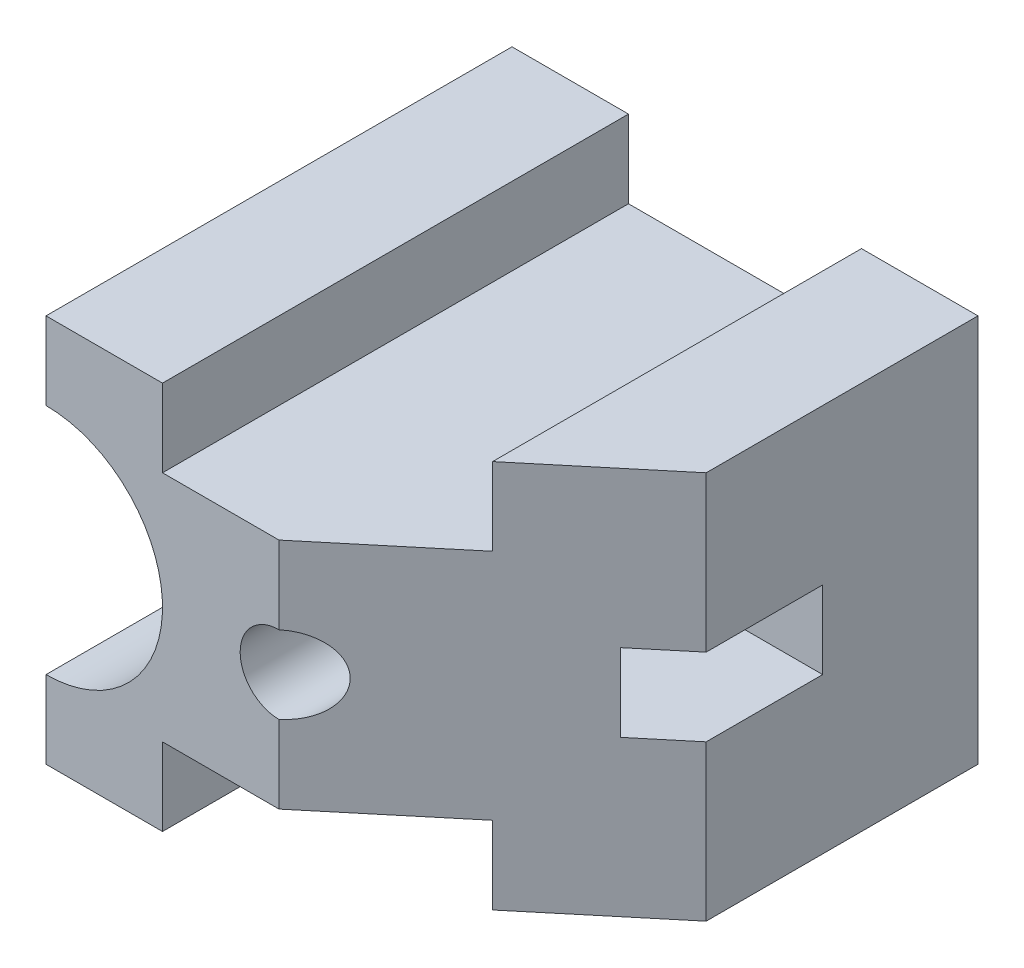
from build123d import *

# Parameters (mm, degrees)
SKETCH1_R           = 5
BOSS_EXTRUDE1_DEPTH = 60
CUT_EXTRUDE3_DEPTH  = 60
SKETCH7_W           = 20
SKETCH7_H           = 10
CUT_EXTRUDE4_DEPTH  = 60


with BuildPart() as part:
    # Sketch1 → Boss-Extrude1 (new body)
    with BuildSketch(Plane.XY):
        with BuildLine():
            Line((-23.203125, -22.890625), (-23.203125, -32.890625))
            Line((-23.203125, -32.890625), (-38.203125, -32.890625))
            Line((-38.203125, -32.890625), (-38.203125, -22.890625))
            ThreePointArc((-38.203125, -22.890625), (-23.203125, -7.890625), (-38.203125, 7.109375))
            Line((-38.203125, 7.109375), (-38.203125, 17.109375))
            Line((-38.203125, 17.109375), (-23.203125, 17.109375))
            Line((-23.203125, 17.109375), (-23.203125, 7.109375))
            Line((-23.203125, 7.109375), (6.796875, 7.109375))
            Line((6.796875, 7.109375), (6.796875, 17.109375))
            Line((6.796875, 17.109375), (21.796875, 17.109375))
            Line((21.796875, 17.109375), (21.796875, -32.890625))
            Line((21.796875, -32.890625), (6.796875, -32.890625))
            Line((6.796875, -32.890625), (6.796875, -22.890625))
            Line((6.796875, -22.890625), (-23.203125, -22.890625))
        make_face()
        with Locations((-8.203125, -7.890625)):
            Circle(SKETCH1_R, mode=Mode.SUBTRACT)
    extrude(amount=BOSS_EXTRUDE1_DEPTH)

    # Sketch3 → Cut-Extrude3 (cut)
    with BuildSketch(Plane(origin=(0, 17.109375, 0), x_dir=(1, 0, 0), z_dir=(0, 1, 0))):
        Polygon((-8.203125, -60), (21.796875, -35), (21.796875, -60), align=None)
    extrude(amount=-CUT_EXTRUDE3_DEPTH, mode=Mode.SUBTRACT)

    # Sketch7 → Cut-Extrude4 (cut)
    with BuildSketch(Plane(origin=(21.796875, 0, 0), x_dir=(0, 0, -1), z_dir=(1, 0, 0))):
        with Locations((-30, -7.890625)):
            Rectangle(SKETCH7_W, SKETCH7_H)
    extrude(amount=-CUT_EXTRUDE4_DEPTH, mode=Mode.SUBTRACT)


solid = part.part
